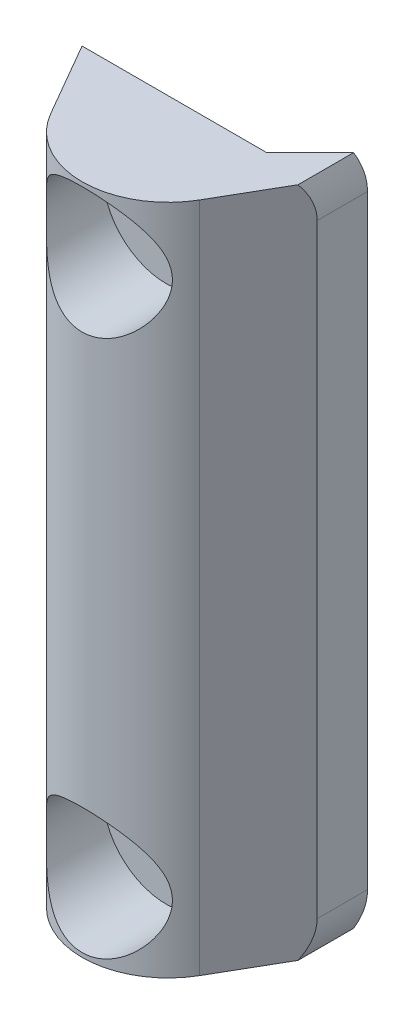
from build123d import *

# Parameters (mm, degrees)
EXTRUDE_1_DEPTH          = 40
CUT_EXTRUDE_1_REACH      = 43.207
CUT_EXTRUDE_1_END_RADIUS = 5.124355653
SKETCH_3_R               = 1.6
CUT_EXTRUDE_2_REACH      = 45.207
CUT_EXTRUDE_2_END_RADIUS = 5.124355653
CUT_EXTRUDE_START        = -2
SKETCH_4_R               = 3.75
CUT_EXTRUDE_3_REACH      = 43.207
EXTRUDE_2_REACH          = 42.93
CUT_EXTRUDE_4_REACH      = 43.207


with BuildPart() as part:
    # 草图1 → 凸台-拉伸1 (new body)
    with BuildSketch(Plane(origin=(0, 0, 0), x_dir=(1, 0, 0), z_dir=(0, 1, 0))):
        with BuildLine():
            Line((-4.437822174, -2.562177826), (-7, 1.875644347))
            Line((-7, 1.875644347), (7, 1.875644347))
            Line((7, 1.875644347), (4.437822174, -2.562177826))
            ThreePointArc((4.437822174, -2.562177826), (0, -5.124355653), (-4.437822174, -2.562177826))
        make_face()
    extrude(amount=EXTRUDE_1_DEPTH)

    # 切除-拉伸1: up to this cylinder (the profile starts inside it)
    cut_extrude_1_end = Plane(origin=(0, 20, 0), z_dir=(0, -1, 0)) * Cylinder(CUT_EXTRUDE_1_END_RADIUS, 129.662711306, mode=Mode.PRIVATE)
    # 草图3 → 切除-拉伸1 (cut, up to the surface)
    with BuildSketch(Plane(origin=(0, 0, -1.875644347), x_dir=(-1, 0, 0), z_dir=(0, 0, -1)), mode=Mode.PRIVATE) as cut_extrude_1_sk1:
        with Locations((0, 4)):
            Circle(SKETCH_3_R)
    cut_extrude_1_tool1 = extrude(cut_extrude_1_sk1.sketch, amount=-CUT_EXTRUDE_1_REACH, mode=Mode.PRIVATE) & cut_extrude_1_end
    add(cut_extrude_1_tool1.solids().sort_by_distance((0, 4, -1.875644))[0], mode=Mode.SUBTRACT)
    # 草图3 → 切除-拉伸1 (cut, up to the surface)
    with BuildSketch(Plane(origin=(0, 0, -1.875644347), x_dir=(-1, 0, 0), z_dir=(0, 0, -1)), mode=Mode.PRIVATE) as cut_extrude_1_sk2:
        with Locations((0, 36)):
            Circle(SKETCH_3_R)
    cut_extrude_1_tool2 = extrude(cut_extrude_1_sk2.sketch, amount=-CUT_EXTRUDE_1_REACH, mode=Mode.PRIVATE) & cut_extrude_1_end
    add(cut_extrude_1_tool2.solids().sort_by_distance((0, 36, -1.875644))[0], mode=Mode.SUBTRACT)

    # 切除-拉伸2: up to this cylinder (the profile starts inside it)
    cut_extrude_2_end = Plane(origin=(0, 20, 0), z_dir=(0, -1, 0)) * Cylinder(CUT_EXTRUDE_2_END_RADIUS, 133.662711306, mode=Mode.PRIVATE)
    # 草图4 → 切除-拉伸2 (cut, up to the surface)
    with BuildSketch(Plane(origin=(0, 0, -1.875644347), x_dir=(-1, 0, 0), z_dir=(0, 0, -1)).offset(CUT_EXTRUDE_START), mode=Mode.PRIVATE) as cut_extrude_2_sk1:
        with Locations((0, 4)):
            Circle(SKETCH_4_R)
    cut_extrude_2_tool1 = extrude(cut_extrude_2_sk1.sketch, amount=-CUT_EXTRUDE_2_REACH, mode=Mode.PRIVATE) & cut_extrude_2_end
    add(cut_extrude_2_tool1.solids().sort_by_distance((0, 4, 0.124356))[0], mode=Mode.SUBTRACT)
    # 草图4 → 切除-拉伸2 (cut, up to the surface)
    with BuildSketch(Plane(origin=(0, 0, -1.875644347), x_dir=(-1, 0, 0), z_dir=(0, 0, -1)).offset(CUT_EXTRUDE_START), mode=Mode.PRIVATE) as cut_extrude_2_sk2:
        with Locations((0, 36)):
            Circle(SKETCH_4_R)
    cut_extrude_2_tool2 = extrude(cut_extrude_2_sk2.sketch, amount=-CUT_EXTRUDE_2_REACH, mode=Mode.PRIVATE) & cut_extrude_2_end
    add(cut_extrude_2_tool2.solids().sort_by_distance((0, 36, 0.124356))[0], mode=Mode.SUBTRACT)

    # 草图6 → 切除-拉伸3 (cut, up to next)
    with BuildSketch(Plane(origin=(0, 0, -1.875644347), x_dir=(-1, 0, 0), z_dir=(0, 0, -1)), mode=Mode.PRIVATE) as cut_extrude_3_sk1:
        with BuildLine():
            Line((-7, 2), (-7, 0))
            Line((-7, 0), (-6.582575695, 0))
            ThreePointArc((-6.582575695, 0), (-6.894531565, 0.978451782), (-7, 2))
        make_face()
    cut_extrude_3_tool1 = extrude(cut_extrude_3_sk1.sketch, amount=-CUT_EXTRUDE_3_REACH, mode=Mode.PRIVATE) & part.part
    # 草图6 → 切除-拉伸3 (cut, up to next)
    with BuildSketch(Plane(origin=(0, 0, -1.875644347), x_dir=(-1, 0, 0), z_dir=(0, 0, -1)), mode=Mode.PRIVATE) as cut_extrude_3_sk2:
        with BuildLine():
            Line((-7, 40), (-6.582575695, 40))
            ThreePointArc((-6.582575695, 40), (-6.894531565, 39.021548218), (-7, 38))
            Line((-7, 38), (-7, 40))
        make_face()
    cut_extrude_3_tool2 = extrude(cut_extrude_3_sk2.sketch, amount=-CUT_EXTRUDE_3_REACH, mode=Mode.PRIVATE) & part.part
    add(cut_extrude_3_tool1.solids().sort_by_distance((6.875723, 0.49573, -1.875644))[0], mode=Mode.SUBTRACT)
    add(cut_extrude_3_tool2.solids().sort_by_distance((6.875723, 39.50427, -1.875644))[0], mode=Mode.SUBTRACT)

    # 凸台-拉伸2: up to this face of the body (flat: up to its plane)
    extrude_2_end = Plane(part.part.faces().sort_by_distance((-0.015198687, 40, 1.011851656))[0])
    # 草图7 → 凸台-拉伸2 (add, up to the picked face)
    with BuildSketch(Plane(origin=(0, 0, 0), x_dir=(1, 0, 0), z_dir=(0, 1, 0)), mode=Mode.PRIVATE) as extrude_2_sk1:
        Polygon((7, 1.875644347), (7, 4.875644347), (4, 1.875644347), align=None)
    extrude_2_tool1 = split(extrude(extrude_2_sk1.sketch, amount=EXTRUDE_2_REACH, mode=Mode.PRIVATE), bisect_by=extrude_2_end, keep=Keep.BOTH, mode=Mode.PRIVATE)
    add(extrude_2_tool1.solids().sort_by(Axis((6, 0, -2.875644), (0, 1, 0)))[0])

    # 切除-拉伸4: up to this plane
    cut_extrude_4_end = Plane(origin=(7, 44.242640687, -4.875644347), z_dir=(0.7071067811865476, 0, 0.7071067811865476))
    # 草图8 → 切除-拉伸4 (cut, up to the surface)
    with BuildSketch(Plane.XY.offset(-1.875644347), mode=Mode.PRIVATE) as cut_extrude_4_sk1:
        with BuildLine():
            Line((7, 38), (7, 40))
            Line((7, 40), (6.582575695, 40))
            ThreePointArc((6.582575695, 40), (6.894531565, 39.021548218), (7, 38))
        make_face()
    cut_extrude_4_tool1 = split(extrude(cut_extrude_4_sk1.sketch, amount=-CUT_EXTRUDE_4_REACH, mode=Mode.PRIVATE), bisect_by=cut_extrude_4_end, keep=Keep.BOTH, mode=Mode.PRIVATE)
    add(cut_extrude_4_tool1.solids().sort_by_distance((6.875723, 39.50427, -1.875644))[0], mode=Mode.SUBTRACT)
    # 草图8 → 切除-拉伸4 (cut, up to the surface)
    with BuildSketch(Plane.XY.offset(-1.875644347), mode=Mode.PRIVATE) as cut_extrude_4_sk2:
        with BuildLine():
            Line((6.582575695, 0), (7, 0))
            Line((7, 0), (7, 2))
            ThreePointArc((7, 2), (6.894531565, 0.978451782), (6.582575695, 0))
        make_face()
    cut_extrude_4_tool2 = split(extrude(cut_extrude_4_sk2.sketch, amount=-CUT_EXTRUDE_4_REACH, mode=Mode.PRIVATE), bisect_by=cut_extrude_4_end, keep=Keep.BOTH, mode=Mode.PRIVATE)
    add(cut_extrude_4_tool2.solids().sort_by_distance((6.875723, 0.49573, -1.875644))[0], mode=Mode.SUBTRACT)


solid = part.part
